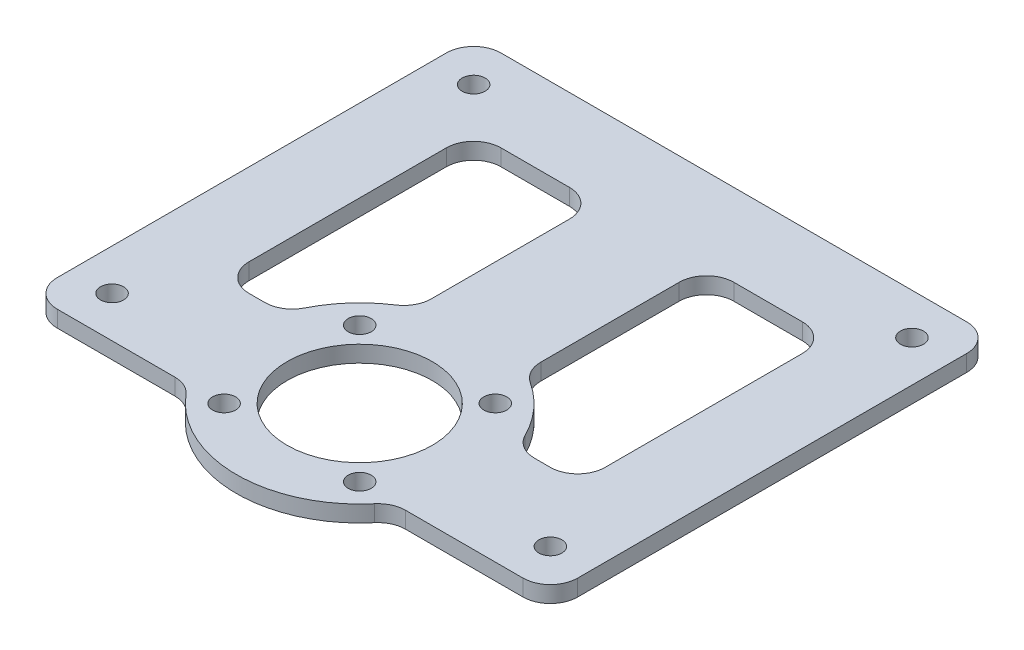
from build123d import *

# Parameters (mm, degrees)
SKETCH_1_R      = 2.1
EXTRUDE_1_DEPTH = 3
FILLET_1_R      = 5
FILLET_2_R      = 5


with BuildPart() as part:
    # ｽｹｯﾁ1 → ﾎﾞｽ - 押し出し1 (new body)
    with BuildSketch(Plane(origin=(0, 0, 0), x_dir=(1, 0, 0), z_dir=(0, 1, 0))):
        with BuildLine():
            Line((-18.109134325, -73.5), (7.5, -73.5))
            Line((7.5, -73.5), (7.5, 7.5))
            Line((7.5, 7.5), (-40, 7.5))
            Line((-40, 7.5), (-87.5, 7.5))
            Line((-87.5, 7.5), (-87.5, -73.5))
            Line((-87.5, -73.5), (-61.890865675, -73.5))
            Line((-61.890865675, -73.5), (-58.573098826, -73.5))
            ThreePointArc((-58.573098826, -73.5), (-40, -83.3), (-21.426901174, -73.5))
            Line((-21.426901174, -73.5), (-18.109134325, -73.5))
        make_face()
        with Locations((-80, -66)):
            Circle(SKETCH_1_R, mode=Mode.SUBTRACT)
        with BuildLine():
            ThreePointArc((-50.274368671, -73.174368671), (-50.280728356, -73.337678908), (-50.299768893, -73.5))
            ThreePointArc((-50.299768893, -73.5), (-54.468008985, -73.011058434), (-50.274368671, -73.174368671))
        make_face(mode=Mode.SUBTRACT)
        with Locations((-52.374368671, -48.425631329)):
            Circle(SKETCH_1_R, mode=Mode.SUBTRACT)
        with BuildLine():
            ThreePointArc((-25.525631329, -73.174368671), (-27.462321092, -75.268008985), (-29.700231107, -73.5))
            ThreePointArc((-29.700231107, -73.5), (-27.788941566, -71.080728356), (-25.525631329, -73.174368671))
        make_face(mode=Mode.SUBTRACT)
        with BuildLine():
            ThreePointArc((-36.22210376, -73.5), (-40, -74.05), (-43.77789624, -73.5))
            ThreePointArc((-43.77789624, -73.5), (-47.921659385, -50.178803618), (-26.75, -60.8))
            ThreePointArc((-26.75, -60.8), (-29.378803618, -68.721659385), (-36.22210376, -73.5))
        make_face(mode=Mode.SUBTRACT)
        with Locations((0, -66)):
            Circle(SKETCH_1_R, mode=Mode.SUBTRACT)
        with Locations((-27.625631329, -48.425631329)):
            Circle(SKETCH_1_R, mode=Mode.SUBTRACT)
        with BuildLine():
            Line((-72.5, -53.5), (-72.5, -7.5))
            Line((-72.5, -7.5), (-50, -7.5))
            Line((-50, -7.5), (-50, -40.644355629))
            ThreePointArc((-50, -40.644355629), (-56.910682506, -45.958207076), (-61.282856951, -53.5))
            Line((-61.282856951, -53.5), (-72.5, -53.5))
        make_face(mode=Mode.SUBTRACT)
        with Locations((-80, 0)):
            Circle(SKETCH_1_R, mode=Mode.SUBTRACT)
        with BuildLine():
            Line((-7.5, -7.5), (-7.5, -53.5))
            Line((-7.5, -53.5), (-18.717143049, -53.5))
            ThreePointArc((-18.717143049, -53.5), (-23.089317494, -45.958207076), (-30, -40.644355629))
            Line((-30, -40.644355629), (-30, -7.5))
            Line((-30, -7.5), (-7.5, -7.5))
        make_face(mode=Mode.SUBTRACT)
        Circle(SKETCH_1_R, mode=Mode.SUBTRACT)
    extrude(amount=EXTRUDE_1_DEPTH)

    # ﾌｨﾚｯﾄ1
    fillet_1_edges = [part.edges().sort_by_distance(p)[0] for p in [
        (-30, 1.5, 40.644355629),
        (-7.5, 1.5, 7.5),
        (-30, 1.5, 7.5),
        (-50, 1.5, 7.5),
        (-50, 1.5, 40.644355629),
        (-72.5, 1.5, 7.5),
        (-7.5, 1.5, 53.5),
        (-18.717143049, 1.5, 53.5),
        (-61.282856951, 1.5, 53.5),
        (-72.5, 1.5, 53.5),
    ]]
    fillet(fillet_1_edges, radius=FILLET_1_R)

    # ﾌｨﾚｯﾄ2
    fillet_2_edges = [part.edges().sort_by_distance(p)[0] for p in [
        (-87.5, 1.5, -7.5),
        (7.5, 1.5, -7.5),
        (7.5, 1.5, 73.5),
        (-87.5, 1.5, 73.5),
        (-21.426901174, 1.5, 73.5),
        (-58.573098826, 1.5, 73.5),
    ]]
    fillet(fillet_2_edges, radius=FILLET_2_R)


solid = part.part
